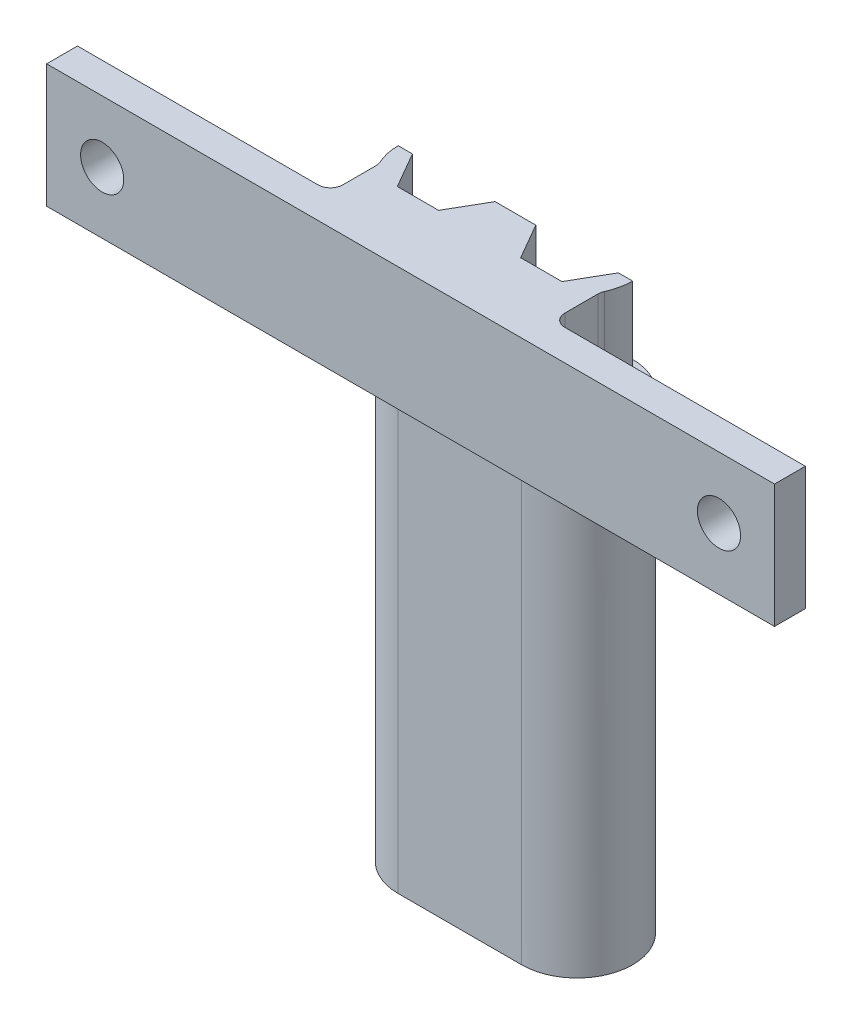
from build123d import *

# Parameters (mm, degrees)
SKETCH1_R           = 1.75
BOSS_EXTRUDE1_DEPTH = 48
CUT_EXTRUDE1_DEPTH  = 44
BOSS_EXTRUDE2_START = -10
BOSS_EXTRUDE2_DEPTH = 10
CUT_EXTRUDE2_START  = -10
CUT_EXTRUDE2_DEPTH  = 10
FILLET3_R           = 1
SKETCH6_R           = 1.75
CUT_EXTRUDE3_DEPTH  = 10


with BuildPart() as part:
    # Sketch1 → Boss-Extrude1 (new body)
    with BuildSketch(Plane(origin=(0, 0, 0), x_dir=(1, 0, 0), z_dir=(0, 1, 0))):
        with BuildLine():
            Line((-5, 4.5), (5, 4.5))
            ThreePointArc((5, 4.5), (9.5, 0), (5, -4.5))
            Line((5, -4.5), (-5, -4.5))
            ThreePointArc((-5, -4.5), (-9.5, 0), (-5, 4.5))
        make_face()
        with Locations(Location((-5, 0, 0), (0, 0, 270))):
            Circle(SKETCH1_R, mode=Mode.SUBTRACT)
        with Locations(Location((5, 0, 0), (0, 0, 270))):
            Circle(SKETCH1_R, mode=Mode.SUBTRACT)
    extrude(amount=BOSS_EXTRUDE1_DEPTH)

    # Sketch2 → Cut-Extrude1 (cut)
    with BuildSketch(Plane(origin=(0, 48, 0), x_dir=(1, 0, 0), z_dir=(0, 1, 0))):
        Polygon((-1.651368439, 0), (-3.325684219, 2.9), (-6.674315781, 2.9), (-8.348631561, 0), (-6.674315781, -2.9), (-3.325684219, -2.9), align=None)
        Polygon((3.325684219, -2.9), (1.651368439, 0), (3.325684219, 2.9), (6.674315781, 2.9), (8.348631561, 0), (6.674315781, -2.9), align=None)
    extrude(amount=-CUT_EXTRUDE1_DEPTH, mode=Mode.SUBTRACT)

    # Sketch4 → Boss-Extrude2 (add)
    with BuildSketch(Plane(origin=(0, 48, 0), x_dir=(1, 0, 0), z_dir=(0, 1, 0)).offset(BOSS_EXTRUDE2_START)):
        with BuildLine():
            Line((-5, -4.5), (5, -4.5))
            ThreePointArc((5, -4.5), (7.342329219, -3.842329219), (9, -2.061552813))
            Line((9, -2.061552813), (9, -6))
            Line((9, -6), (29.5, -6))
            Line((29.5, -6), (29.5, -8.5))
            Line((29.5, -8.5), (10.5, -8.5))
            Line((10.5, -8.5), (-10.5, -8.5))
            Line((-10.5, -8.5), (-29.5, -8.5))
            Line((-29.5, -8.5), (-29.5, -6))
            Line((-29.5, -6), (-9, -6))
            Line((-9, -6), (-9, -2.061552813))
            ThreePointArc((-9, -2.061552813), (-7.342329219, -3.842329219), (-5, -4.5))
        make_face()
    extrude(amount=BOSS_EXTRUDE2_DEPTH)

    # Sketch5 → Cut-Extrude2 (cut)
    with BuildSketch(Plane(origin=(0, 48, 0), x_dir=(1, 0, 0), z_dir=(0, 1, 0)).offset(CUT_EXTRUDE2_START)):
        with BuildLine():
            Line((-9.5, 0), (9.5, 0))
            ThreePointArc((9.5, 0), (8.181980515, 3.181980515), (5, 4.5))
            Line((5, 4.5), (-5, 4.5))
            ThreePointArc((-5, 4.5), (-8.181980515, 3.181980515), (-9.5, 0))
        make_face()
    extrude(amount=CUT_EXTRUDE2_DEPTH, mode=Mode.SUBTRACT)

    # Fillet3
    fillet3_edges = [part.edges().sort_by_distance(p)[0] for p in [
        (-9, 43, 6),
        (-9, 43, 2.061552813),
        (9, 43, 2.061552813),
        (9, 43, 6),
    ]]
    fillet(fillet3_edges, radius=FILLET3_R)

    # Sketch6 → Cut-Extrude3 (cut)
    with BuildSketch(Plane.XY.offset(8.5)):
        with Locations((-25, 43)):
            Circle(SKETCH6_R)
        with Locations((25, 43)):
            Circle(SKETCH6_R)
    extrude(amount=-CUT_EXTRUDE3_DEPTH, mode=Mode.SUBTRACT)


solid = part.part
